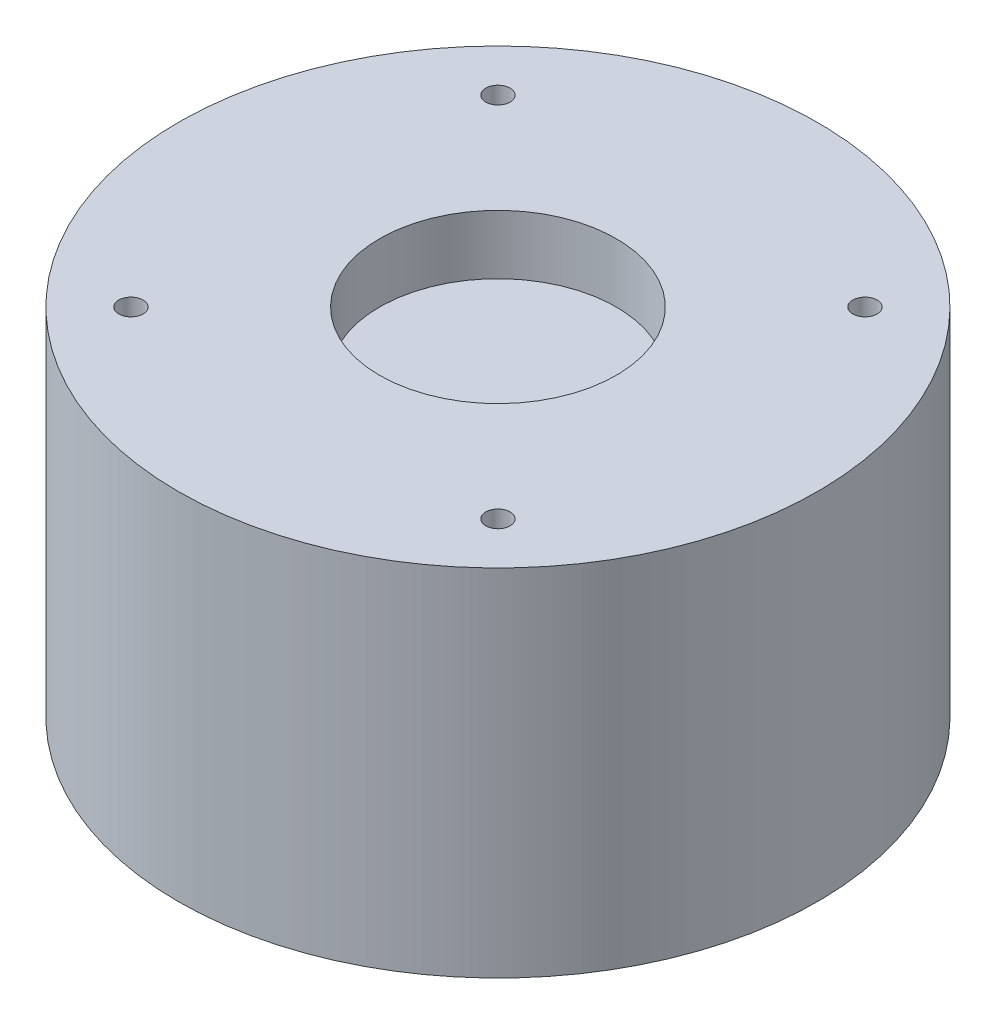
from build123d import *

# Parameters (mm, degrees)
SKETCH_1_R           = 27
EXTRUDE_1_DEPTH      = 30
HOLE_WIZARD_M2_5_1_D = 2.05
SKETCH_7_R           = 2.5
CUT_EXTRUDE_1_DEPTH  = 24
SKETCH_8_R           = 10
CUT_EXTRUDE_2_DEPTH  = 5


with BuildPart() as part:
    # 草图1 → 凸台-拉伸1 (new body)
    with BuildSketch(Plane(origin=(0, 0, 0), x_dir=(1, 0, 0), z_dir=(0, 1, 0))):
        with Locations(Location((0, 0, 0), (0, 0, 270))):
            Circle(SKETCH_1_R)
    extrude(amount=EXTRUDE_1_DEPTH)

    # M2.5 螺纹孔1 (through all)
    with Locations(Plane(origin=(0, 0, 0), x_dir=(-1, 0, 0), z_dir=(0, -1, 0))):
        with Locations((15.5, 15.5), (-15.5, 15.5), (-15.5, -15.5), (15.5, -15.5)):
            Hole(HOLE_WIZARD_M2_5_1_D / 2)

    # 草图7 → 切除-拉伸1 (cut)
    with BuildSketch(Plane.XZ):
        with Locations(Location((0, 0, 0), (0, 0, 270))):
            Circle(SKETCH_7_R)
    extrude(amount=-CUT_EXTRUDE_1_DEPTH, mode=Mode.SUBTRACT)

    # 草图8 → 切除-拉伸2 (cut)
    with BuildSketch(Plane(origin=(0, 30, 0), x_dir=(1, 0, 0), z_dir=(0, 1, 0))):
        with Locations(Location((0, 0, 0), (0, 0, 270))):
            Circle(SKETCH_8_R)
    extrude(amount=-CUT_EXTRUDE_2_DEPTH, mode=Mode.SUBTRACT)


solid = part.part
